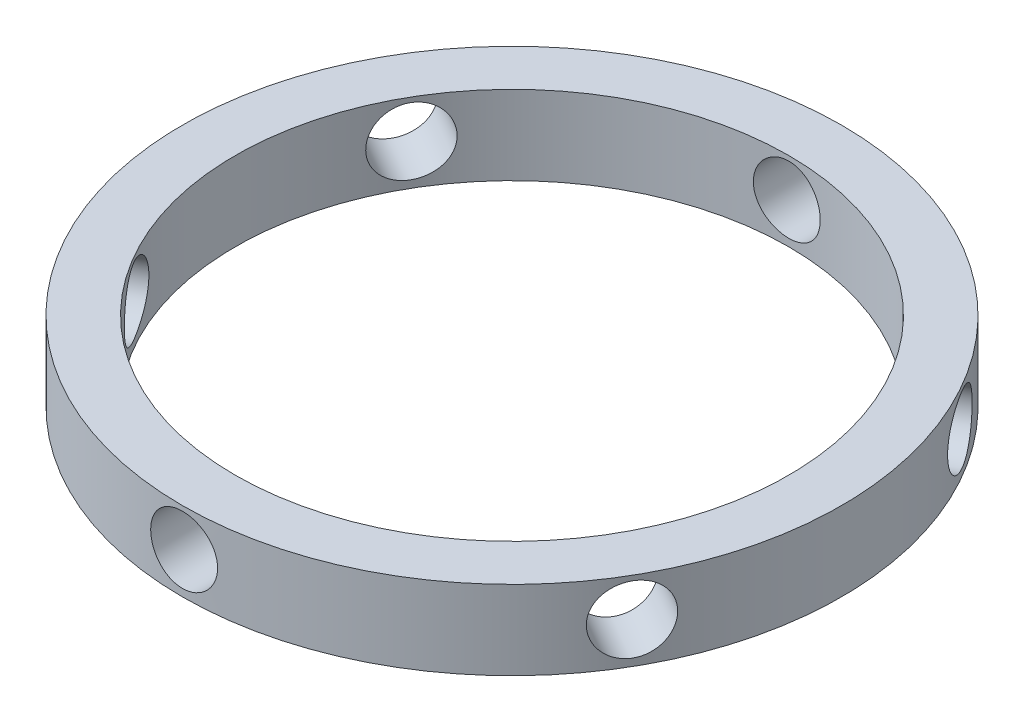
from build123d import *

# Parameters (mm, degrees)
SKETCH_1_R               = 50
EXTRUDE_1_DEPTH          = 12
SKETCH_4_R               = 5.075
CUT_EXTRUDE_5_DEPTH      = 72.721684308
PATTERN_CIRCULAR_3_COUNT = 6
SKETCH_27_R              = 42
CUT_EXTRUDE_7_DEPTH      = 72.721684464


with BuildPart() as part:
    # 草图1 → 凸台-拉伸1 (new body)
    with BuildSketch(Plane(origin=(0, 0, 0), x_dir=(1, 0, 0), z_dir=(0, 1, 0))):
        with Locations(Location((0, 0, 0), (0, 0, 270))):
            Circle(SKETCH_1_R)
    extrude(amount=EXTRUDE_1_DEPTH)

    # 草图4 → 切除-拉伸5 (cut, through all)
    with BuildSketch(Plane.XY):
        with Locations((0, 6.19163712)):
            Circle(SKETCH_4_R)
    cut_extrude_5 = extrude(amount=-CUT_EXTRUDE_5_DEPTH, mode=Mode.SUBTRACT)

    # 阵列(圆周)3: 切除-拉伸5 ×6 about axis
    pattern_circular_3_axis = Axis((0, 0, 0), (0, 1, 0))
    for i in range(1, PATTERN_CIRCULAR_3_COUNT):
        add(cut_extrude_5.rotate(pattern_circular_3_axis, i * 360 / PATTERN_CIRCULAR_3_COUNT), mode=Mode.SUBTRACT)

    # 草图27 → 切除-拉伸7 (cut, through all)
    with BuildSketch(Plane.XZ):
        with Locations(Location((0, 0, 0), (0, 0, 270))):
            Circle(SKETCH_27_R)
    extrude(amount=-CUT_EXTRUDE_7_DEPTH, mode=Mode.SUBTRACT)


solid = part.part
